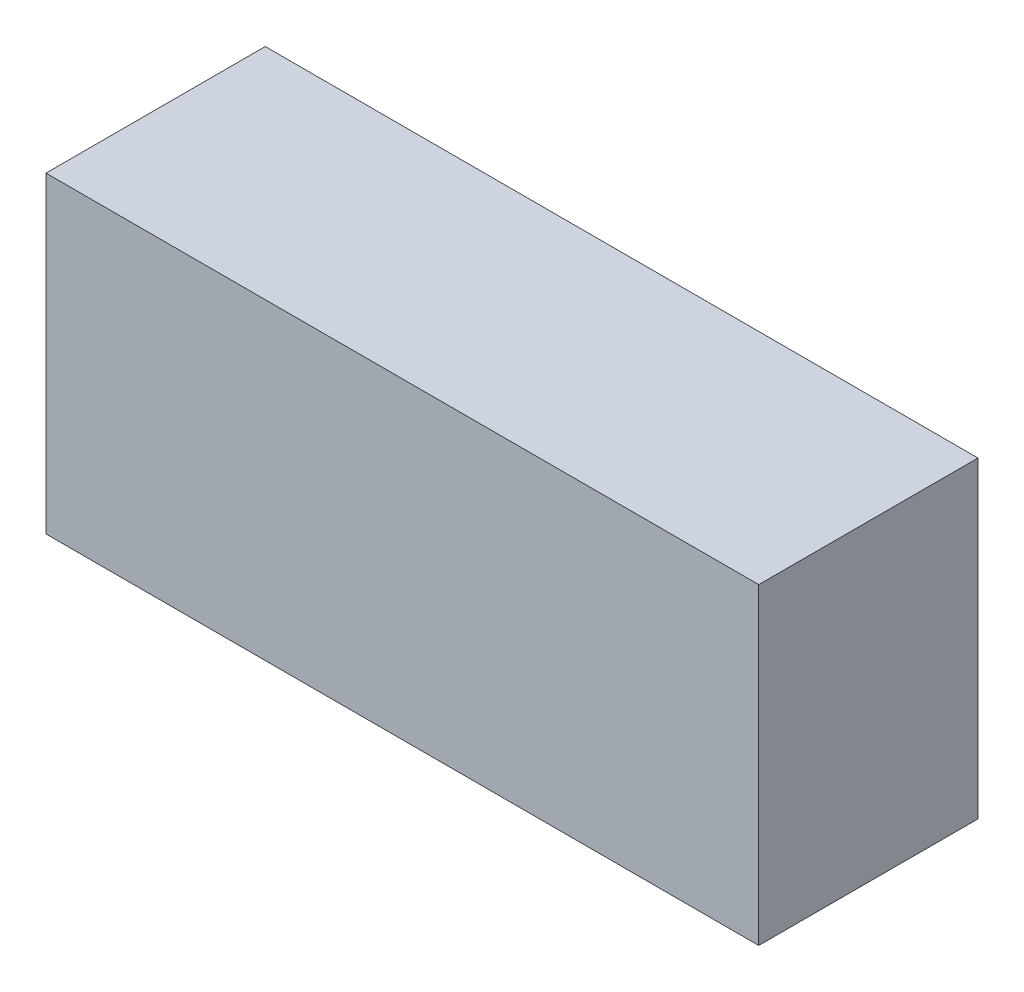
from build123d import *

# Parameters (mm, degrees)
SKETCH1_W               = 3.2508
SKETCH1_H               = 1.4254
COMPONENT_OUTLINE_DEPTH = 1


with BuildPart() as part:
    # Sketch1 → Component_Outline (new body)
    with BuildSketch(Plane.XY):
        with Locations((0, 0.0127)):
            Rectangle(SKETCH1_W, SKETCH1_H)
    extrude(amount=COMPONENT_OUTLINE_DEPTH)


solid = part.part
